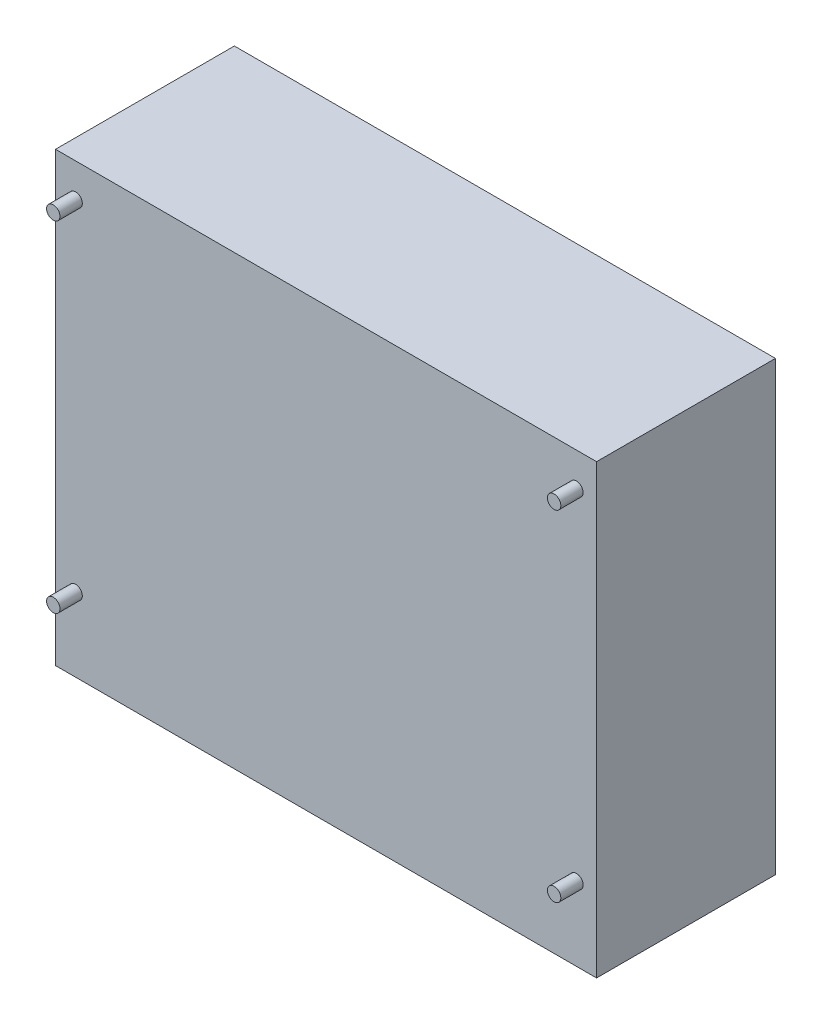
from build123d import *

# Parameters (mm, degrees)
SKETCH_1_W          = 121
SKETCH_1_H          = 100
EXTRUDE_1_DEPTH     = 40
SKETCH_2_R          = 1.5
EXTRUDE_2_DEPTH     = 5
SKETCH_3_W          = 117
SKETCH_3_H          = 96
CUT_EXTRUDE_1_DEPTH = 38
SKETCH_4_W          = 117
SKETCH_4_H          = 96
EXTRUDE_3_DEPTH     = 2


with BuildPart() as part:
    # 草图1 → 凸台-拉伸1 (new body)
    with BuildSketch(Plane.XY):
        with Locations((-60.5, 50)):
            Rectangle(SKETCH_1_W, SKETCH_1_H)
    extrude(amount=EXTRUDE_1_DEPTH)

    # 草图2 → 凸台-拉伸2 (add)
    with BuildSketch(Plane.XY.offset(40)):
        with Locations((-116.5, 92.5)):
            Circle(SKETCH_2_R)
        with Locations((-4.5, 92.5)):
            Circle(SKETCH_2_R)
        with Locations((-116.5, 16.5)):
            Circle(SKETCH_2_R)
        with Locations((-4.5, 16.5)):
            Circle(SKETCH_2_R)
    extrude(amount=EXTRUDE_2_DEPTH)

    # 草图3 → 切除-拉伸1 (cut)
    with BuildSketch(Plane(origin=(0, 0, 0), x_dir=(-1, 0, 0), z_dir=(0, 0, -1))):
        with Locations((60.5, 50)):
            Rectangle(SKETCH_3_W, SKETCH_3_H)
    extrude(amount=-CUT_EXTRUDE_1_DEPTH, mode=Mode.SUBTRACT)

    # 草图4 → 凸台-拉伸3 (add)
    with BuildSketch(Plane(origin=(0, 0, 0), x_dir=(-1, 0, 0), z_dir=(0, 0, -1))):
        with Locations((60.5, 50)):
            Rectangle(SKETCH_4_W, SKETCH_4_H)
    extrude(amount=-EXTRUDE_3_DEPTH)


solid = part.part
